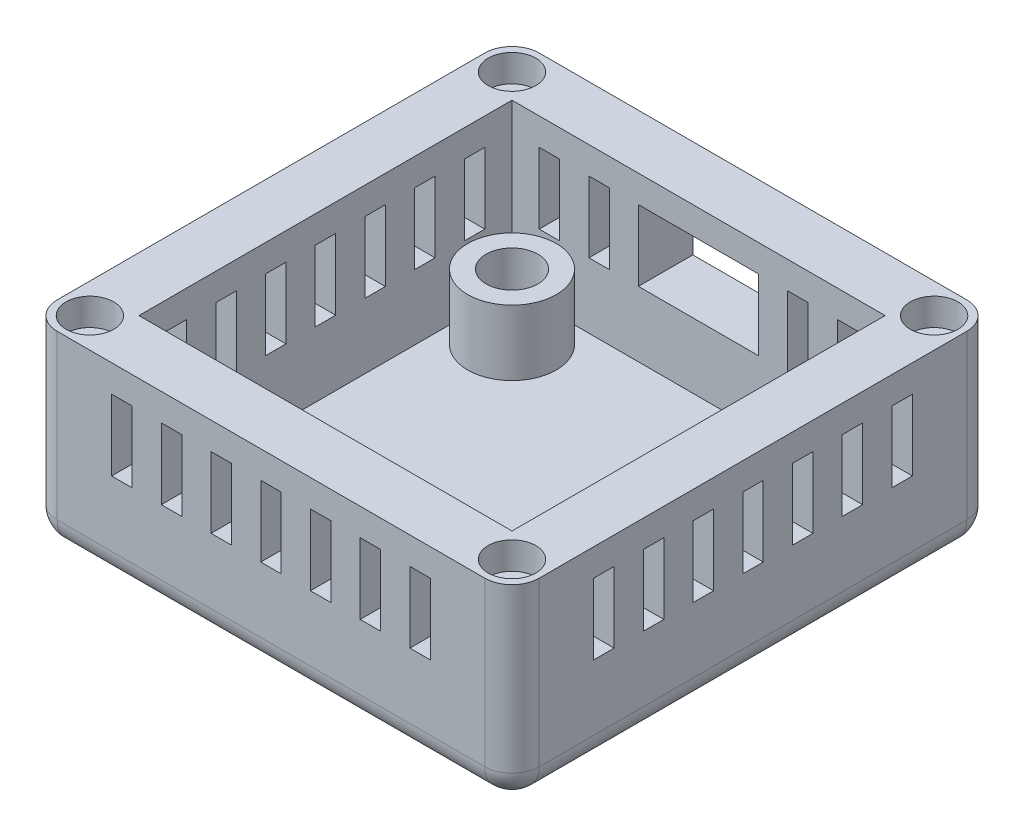
from build123d import *

# Parameters (mm, degrees)
ESQUISSE1_W              = 35.4
ESQUISSE1_H              = 35.4
BOSS_EXTRU_1_DEPTH       = 14
ESQUISSE2_W              = 27.4
ESQUISSE2_H              = 27.4
ENL_V_MAT_EXTRU_1_DEPTH  = 12
ESQUISSE4_R              = 3.25
ESQUISSE4_R_2            = 1.9
BOSS_EXTRU_2_DEPTH       = 4.8
ESQUISSE5_R              = 1.75
ENL_V_MAT_EXTRU_2_DEPTH  = 2
CONG_6_R                 = 2
ESQUISSE9_W              = 1.5
ESQUISSE9_H              = 5.2
ENL_V_MAT_EXTRU_9_DEPTH  = 4
ESQUISSE8_W              = 1.5
ESQUISSE8_H              = 5.2
ENL_V_MAT_EXTRU_10_DEPTH = 4
ESQUISSE7_W              = 1.5
ESQUISSE7_H              = 5.2
ENL_V_MAT_EXTRU_11_DEPTH = 4
ESQUISSE6_W              = 1.5
ESQUISSE6_H              = 5.2
ENL_V_MAT_EXTRU_12_DEPTH = 4
ESQUISSE10_W             = 8.819289119
ESQUISSE10_H             = 5.2
ENL_V_MAT_EXTRU_13_DEPTH = 6


with BuildPart() as part:
    # Esquisse1 → Boss.-Extru.1 (new body)
    with BuildSketch(Plane(origin=(0, 0, 0), x_dir=(1, 0, 0), z_dir=(0, 1, 0))):
        Rectangle(ESQUISSE1_W, ESQUISSE1_H)
    extrude(amount=BOSS_EXTRU_1_DEPTH)

    # Esquisse2 → Enlèv. mat.-Extru.1 (cut)
    with BuildSketch(Plane(origin=(0, 14, 0), x_dir=(1, 0, 0), z_dir=(0, 1, 0))):
        Rectangle(ESQUISSE2_W, ESQUISSE2_H)
    extrude(amount=-ENL_V_MAT_EXTRU_1_DEPTH, mode=Mode.SUBTRACT)

    # Esquisse4 → Boss.-Extru.2 (add)
    # profile 1 of 4: a face of its own
    with BuildSketch(Plane(origin=(0, 2, 0), x_dir=(1, 0, 0), z_dir=(0, 1, 0))):
        with Locations(Location((-10.16, 10.16, 0), (0, 0, 270))):
            Circle(ESQUISSE4_R)
        with Locations(Location((-10.16, 10.16, 0), (0, 0, 270))):
            Circle(ESQUISSE4_R_2, mode=Mode.SUBTRACT)
    # profile 2 of 4: a face of its own
    with BuildSketch(Plane(origin=(0, 2, 0), x_dir=(1, 0, 0), z_dir=(0, 1, 0))):
        with Locations(Location((10.16, 10.16, 0), (0, 0, 270))):
            Circle(ESQUISSE4_R)
        with Locations(Location((10.16, 10.16, 0), (0, 0, 270))):
            Circle(ESQUISSE4_R_2, mode=Mode.SUBTRACT)
    # profile 3 of 4: a face of its own
    with BuildSketch(Plane(origin=(0, 2, 0), x_dir=(1, 0, 0), z_dir=(0, 1, 0))):
        with Locations(Location((10.16, -10.16, 0), (0, 0, 270))):
            Circle(ESQUISSE4_R)
        with Locations(Location((10.16, -10.16, 0), (0, 0, 270))):
            Circle(ESQUISSE4_R_2, mode=Mode.SUBTRACT)
    # profile 4 of 4: a face of its own
    with BuildSketch(Plane(origin=(0, 2, 0), x_dir=(1, 0, 0), z_dir=(0, 1, 0))):
        with Locations(Location((-10.16, -10.16, 0), (0, 0, 270))):
            Circle(ESQUISSE4_R)
        with Locations(Location((-10.16, -10.16, 0), (0, 0, 270))):
            Circle(ESQUISSE4_R_2, mode=Mode.SUBTRACT)
    extrude(amount=BOSS_EXTRU_2_DEPTH)

    # Esquisse5 → Enlèv. mat.-Extru.2 (cut)
    with BuildSketch(Plane(origin=(0, 14, 0), x_dir=(1, 0, 0), z_dir=(0, 1, 0))):
        with Locations(Location((15.5, 15.5, 0), (0, 0, 270))):
            Circle(ESQUISSE5_R)
        with Locations(Location((-15.5, 15.5, 0), (0, 0, 270))):
            Circle(ESQUISSE5_R)
        with Locations(Location((-15.5, -15.5, 0), (0, 0, 270))):
            Circle(ESQUISSE5_R)
        with Locations(Location((15.5, -15.5, 0), (0, 0, 270))):
            Circle(ESQUISSE5_R)
    extrude(amount=-ENL_V_MAT_EXTRU_2_DEPTH, mode=Mode.SUBTRACT)

    # Congé6
    cong_6_edges = [part.edges().sort_by_distance(p)[0] for p in [
        (0, 0, 17.7),
        (-17.7, 0, 0),
        (0, 0, -17.7),
        (17.7, 0, 0),
        (17.7, 7, 17.7),
        (-17.7, 7, 17.7),
        (-17.7, 7, -17.7),
        (17.7, 7, -17.7),
    ]]
    fillet(cong_6_edges, radius=CONG_6_R)

    # Esquisse9 → Enlèv. mat.-Extru.9 (cut)
    with BuildSketch(Plane(origin=(0, 0, -17.7), x_dir=(-1, 0, 0), z_dir=(0, 0, -1))):
        with Locations((-10.95, 9.4)):
            Rectangle(ESQUISSE9_W, ESQUISSE9_H)
        with Locations((-7.3, 9.4)):
            Rectangle(ESQUISSE9_W, ESQUISSE9_H)
        with Locations((-3.65, 9.4)):
            Rectangle(ESQUISSE9_W, ESQUISSE9_H)
        with Locations((0, 9.4)):
            Rectangle(ESQUISSE9_W, ESQUISSE9_H)
        with Locations((3.65, 9.4)):
            Rectangle(ESQUISSE9_W, ESQUISSE9_H)
        with Locations((7.3, 9.4)):
            Rectangle(ESQUISSE9_W, ESQUISSE9_H)
        with Locations((10.95, 9.4)):
            Rectangle(ESQUISSE9_W, ESQUISSE9_H)
    extrude(amount=-ENL_V_MAT_EXTRU_9_DEPTH, mode=Mode.SUBTRACT)

    # Esquisse8 → Enlèv. mat.-Extru.10 (cut)
    with BuildSketch(Plane.XY.offset(17.7)):
        with Locations((-10.95, 9.4)):
            Rectangle(ESQUISSE8_W, ESQUISSE8_H)
        with Locations((-7.3, 9.4)):
            Rectangle(ESQUISSE8_W, ESQUISSE8_H)
        with Locations((-3.65, 9.4)):
            Rectangle(ESQUISSE8_W, ESQUISSE8_H)
        with Locations((0, 9.4)):
            Rectangle(ESQUISSE8_W, ESQUISSE8_H)
        with Locations((3.65, 9.4)):
            Rectangle(ESQUISSE8_W, ESQUISSE8_H)
        with Locations((7.3, 9.4)):
            Rectangle(ESQUISSE8_W, ESQUISSE8_H)
        with Locations((10.95, 9.4)):
            Rectangle(ESQUISSE8_W, ESQUISSE8_H)
    extrude(amount=-ENL_V_MAT_EXTRU_10_DEPTH, mode=Mode.SUBTRACT)

    # Esquisse7 → Enlèv. mat.-Extru.11 (cut)
    with BuildSketch(Plane.ZY.offset(17.7)):
        with Locations((-10.95, 9.4)):
            Rectangle(ESQUISSE7_W, ESQUISSE7_H)
        with Locations((-7.3, 9.4)):
            Rectangle(ESQUISSE7_W, ESQUISSE7_H)
        with Locations((-3.65, 9.4)):
            Rectangle(ESQUISSE7_W, ESQUISSE7_H)
        with Locations((0, 9.4)):
            Rectangle(ESQUISSE7_W, ESQUISSE7_H)
        with Locations((3.65, 9.4)):
            Rectangle(ESQUISSE7_W, ESQUISSE7_H)
        with Locations((7.3, 9.4)):
            Rectangle(ESQUISSE7_W, ESQUISSE7_H)
        with Locations((10.95, 9.4)):
            Rectangle(ESQUISSE7_W, ESQUISSE7_H)
    extrude(amount=-ENL_V_MAT_EXTRU_11_DEPTH, mode=Mode.SUBTRACT)

    # Esquisse6 → Enlèv. mat.-Extru.12 (cut)
    with BuildSketch(Plane(origin=(17.7, 0, 0), x_dir=(0, 0, -1), z_dir=(1, 0, 0))):
        with Locations((-10.95, 9.4)):
            Rectangle(ESQUISSE6_W, ESQUISSE6_H)
        with Locations((-7.3, 9.4)):
            Rectangle(ESQUISSE6_W, ESQUISSE6_H)
        with Locations((-3.65, 9.4)):
            Rectangle(ESQUISSE6_W, ESQUISSE6_H)
        with Locations((0, 9.4)):
            Rectangle(ESQUISSE6_W, ESQUISSE6_H)
        with Locations((3.65, 9.4)):
            Rectangle(ESQUISSE6_W, ESQUISSE6_H)
        with Locations((7.3, 9.4)):
            Rectangle(ESQUISSE6_W, ESQUISSE6_H)
        with Locations((10.95, 9.4)):
            Rectangle(ESQUISSE6_W, ESQUISSE6_H)
    extrude(amount=-ENL_V_MAT_EXTRU_12_DEPTH, mode=Mode.SUBTRACT)

    # Esquisse10 → Enlèv. mat.-Extru.13 (cut)
    with BuildSketch(Plane(origin=(0, 0, -17.7), x_dir=(-1, 0, 0), z_dir=(0, 0, -1))):
        with Locations((0.009644559, 9.4)):
            Rectangle(ESQUISSE10_W, ESQUISSE10_H)
    extrude(amount=-ENL_V_MAT_EXTRU_13_DEPTH, mode=Mode.SUBTRACT)


solid = part.part
